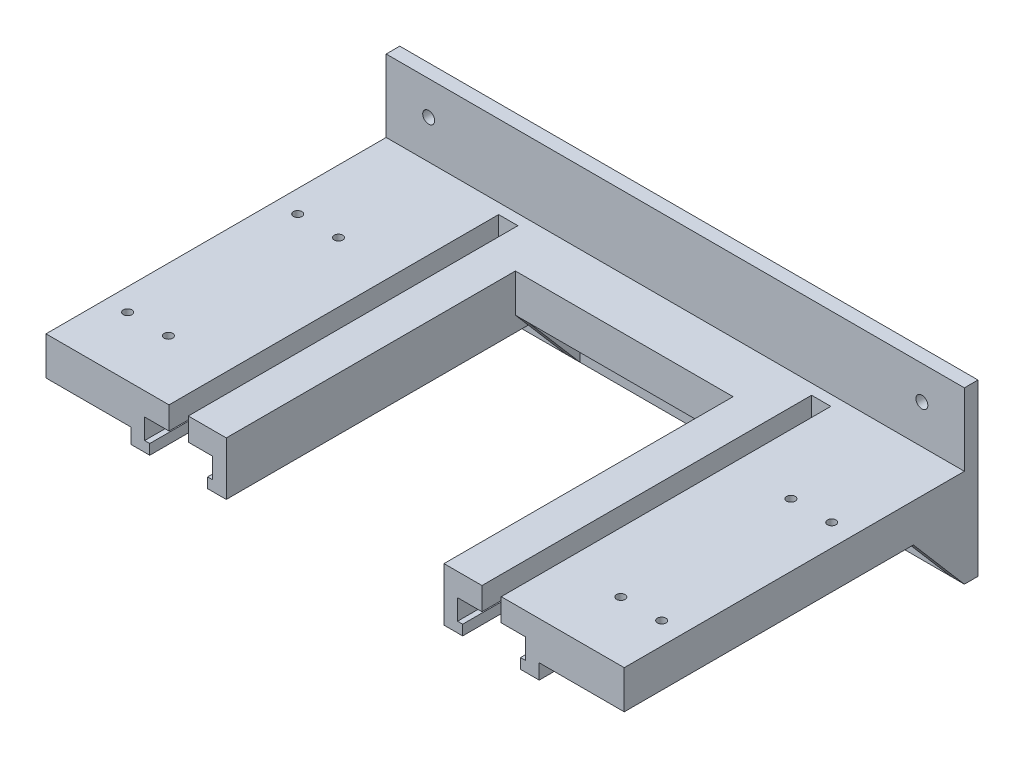
from build123d import *

# Parameters (mm, degrees)
CROQUIS1_W                  = 170
CROQUIS1_H                  = 50
SALIENTE_EXTRUIR1_DEPTH     = 4
SALIENTE_EXTRUIR2_DEPTH     = 100
SALIENTE_EXTRUIR3_DEPTH     = 25
SALIENTE_EXTRUIR4_DEPTH     = 64
SALIENTE_EXTRUIR5_DEPTH     = 25
CROQUIS9_W                  = 17
CROQUIS9_H                  = 17.5
CROQUIS9_W_2                = 56
CORTAR_EXTRUIR1_DEPTH       = 100
CROQUIS11_W                 = 64
CROQUIS11_H                 = 85
CORTAR_EXTRUIR4_DEPTH       = 15
CROQUIS12_R                 = 1.75
CORTAR_EXTRUIR5_DEPTH       = 15
CORTAR_EXTRUIR6_DEPTH       = 1
CROQUIS16_W                 = 170
CROQUIS16_H                 = 3.747948586
CORTAR_EXTRUIR7_DEPTH       = 100
CORTAR_EXTRUIR10_DEPTH      = 139.192800102
CORTAR_EXTRUIR10_DEPTH_BACK = 139.192800102
CROQUIS20_R                 = 1.25
CROQUIS21_W                 = 5.666666666
CROQUIS21_H                 = 96.899748192
CORTAR_EXTRUIR11_DEPTH      = 10


with BuildPart() as part:
    # Croquis1 → Saliente-Extruir1 (new body)
    with BuildSketch(Plane.XY):
        Rectangle(CROQUIS1_W, CROQUIS1_H)
    extrude(amount=SALIENTE_EXTRUIR1_DEPTH)

    # Croquis3 → Saliente-Extruir2 (add)
    with BuildSketch(Plane.XY.offset(4)):
        Polygon((-85, 7.5), (85, 7.5), (85, -7.5), (60, -7.5), (60, -11.921199344), (56, -11.921199344), (54.5, -11.921199344), (54.5, -8.921199344), (56, -8.921199344), (56, -2.921199344), (36, -2.921199344), (36, -8.921199344), (37.5, -8.921199344), (37.5, -11.921199344), (36, -11.921199344), (32, -11.921199344), (32, -7.5), (-32, -7.5), (-32, -11.921199344), (-36, -11.921199344), (-37.5, -11.921199344), (-37.5, -8.921199344), (-36, -8.921199344), (-36, -2.921199344), (-56, -2.921199344), (-56, -8.921199344), (-54.5, -8.921199344), (-54.5, -11.921199344), (-56, -11.921199344), (-60, -11.921199344), (-60, -7.5), (-85, -7.5), align=None)
    extrude(amount=SALIENTE_EXTRUIR2_DEPTH)

    # Croquis4 → Saliente-Extruir3 (add)
    with BuildSketch(Plane.ZY.offset(85)):
        Polygon((4, -25), (19, -7.5), (4, -7.5), align=None)
    extrude(amount=-SALIENTE_EXTRUIR3_DEPTH)

    # Croquis5 → Saliente-Extruir4 (add)
    with BuildSketch(Plane.ZY.offset(-32)):
        Polygon((19, -7.5), (4, -25), (4, -7.5), align=None)
    extrude(amount=SALIENTE_EXTRUIR4_DEPTH)

    # Croquis7 → Saliente-Extruir5 (add)
    with BuildSketch(Plane(origin=(60, 0, 0), x_dir=(0, 0, -1), z_dir=(1, 0, 0))):
        Polygon((-4, -25), (-19, -7.5), (-4, -7.5), align=None)
    extrude(amount=SALIENTE_EXTRUIR5_DEPTH)

    # Croquis9 → Cortar-Extruir1 (cut)
    with BuildSketch(Plane.XY.offset(104)):
        with Locations((-72.5, -16.25)):
            Rectangle(CROQUIS9_W, CROQUIS9_H)
        with Locations((0, -16.25)):
            Rectangle(CROQUIS9_W_2, CROQUIS9_H)
        with Locations((72.5, -16.25)):
            Rectangle(CROQUIS9_W, CROQUIS9_H)
    extrude(amount=-CORTAR_EXTRUIR1_DEPTH, mode=Mode.SUBTRACT)

    # Croquis11 → Cortar-Extruir4 (cut)
    with BuildSketch(Plane.XZ.offset(7.5)):
        with Locations((0, 61.5)):
            Rectangle(CROQUIS11_W, CROQUIS11_H)
    extrude(amount=-CORTAR_EXTRUIR4_DEPTH, mode=Mode.SUBTRACT)

    # Croquis12 → Cortar-Extruir5 (cut)
    with BuildSketch(Plane.XY.offset(4)):
        with Locations((-72.5, 15.138462845)):
            Circle(CROQUIS12_R)
        with Locations((-72.5, -15.138462845)):
            Circle(CROQUIS12_R)
        with Locations((72.5, -15.138462845)):
            Circle(CROQUIS12_R)
        with Locations((72.5, 15.138462845)):
            Circle(CROQUIS12_R)
    extrude(amount=-CORTAR_EXTRUIR5_DEPTH, mode=Mode.SUBTRACT)

    # Croquis14 → Cortar-Extruir6 (cut)
    with BuildSketch(Plane.ZY.offset(85)):
        Polygon((19, -7.5), (4, -7.5), (4, -25), align=None)
    extrude(amount=-CORTAR_EXTRUIR6_DEPTH, mode=Mode.SUBTRACT)

    # Croquis16 → Cortar-Extruir7 (cut)
    with BuildSketch(Plane.XY.offset(104)):
        with Locations((0, 5.626025707)):
            Rectangle(CROQUIS16_W, CROQUIS16_H)
    extrude(amount=-CORTAR_EXTRUIR7_DEPTH, mode=Mode.SUBTRACT)

    # Croquis20 → Cortar-Extruir10 (cut, two sides: drawn at the far end of the back side and taken through both)
    with BuildSketch(Plane.XZ.offset(7.5).offset(-CORTAR_EXTRUIR10_DEPTH_BACK)):
        with Locations(Location((-78.5, 86.5, 0), (0, 0, 270))):
            Circle(CROQUIS20_R)
        with Locations(Location((-66.5, 86.5, 0), (0, 0, 270))):
            Circle(CROQUIS20_R)
        with Locations(Location((-66.5, 36.5, 0), (0, 0, 270))):
            Circle(CROQUIS20_R)
        with Locations(Location((-78.5, 36.5, 0), (0, 0, 270))):
            Circle(CROQUIS20_R)
        with Locations(Location((66.5, 36.5, 0), (0, 0, 270))):
            Circle(CROQUIS20_R)
        with Locations(Location((78.5, 36.5, 0), (0, 0, 270))):
            Circle(CROQUIS20_R)
        with Locations(Location((66.5, 86.5, 0), (0, 0, 270))):
            Circle(CROQUIS20_R)
        with Locations(Location((78.5, 86.5, 0), (0, 0, 270))):
            Circle(CROQUIS20_R)
    extrude(amount=CORTAR_EXTRUIR10_DEPTH + CORTAR_EXTRUIR10_DEPTH_BACK, mode=Mode.SUBTRACT)

    # Croquis21 → Cortar-Extruir11 (cut)
    with BuildSketch(Plane.XZ.offset(2.921199344)):
        with Locations((-46, 55.550125904)):
            Rectangle(CROQUIS21_W, CROQUIS21_H)
        with Locations((46, 55.550125904)):
            Rectangle(CROQUIS21_W, CROQUIS21_H)
    extrude(amount=-CORTAR_EXTRUIR11_DEPTH, mode=Mode.SUBTRACT)


solid = part.part
